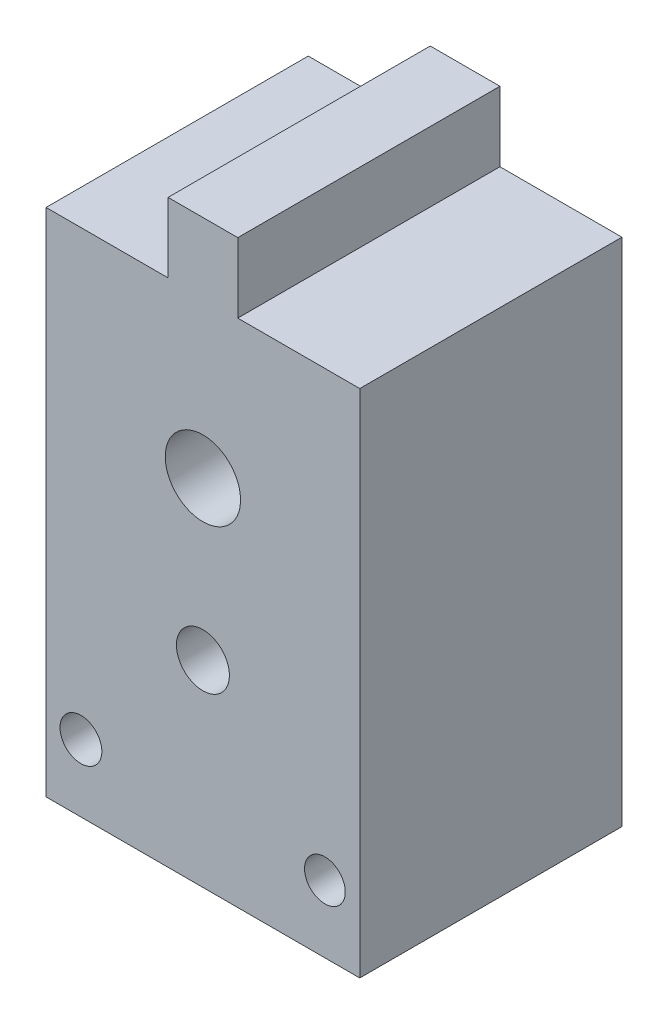
from build123d import *

# Parameters (mm, degrees)
SKETCH1_R           = 1.896742857
SKETCH1_R_2         = 1.45833049
SKETCH1_R_3         = 1.497428571
SKETCH1_R_4         = 2.695371429
BOSS_EXTRUDE1_DEPTH = 9.3865


with BuildPart() as part:
    # Sketch1 → Boss-Extrude1 (new, symmetric)
    with BuildSketch(Plane.XY):
        Polygon((-2.495714286, 15.780977349), (-11.230714286, 15.780977349), (-11.230714286, -20.77240592), (11.230714286, -20.77240592), (11.230714286, 15.780977349), (2.495714286, 15.780977349), (2.495714286, 20.77240592), (-2.495714286, 20.77240592), align=None)
        with Locations(Location((0, -6.680451222, 0), (0, 0, 180))):
            Circle(SKETCH1_R, mode=Mode.SUBTRACT)
        with Locations(Location((8.735, -15.964508365, 0), (0, 0, 180))):
            Circle(SKETCH1_R_2, mode=Mode.SUBTRACT)
        with Locations(Location((-8.735, -15.964508365, 0), (0, 0, 180))):
            Circle(SKETCH1_R_3, mode=Mode.SUBTRACT)
        with Locations(Location((0, 4.600177349, 0), (0, 0, 180))):
            Circle(SKETCH1_R_4, mode=Mode.SUBTRACT)
    extrude(amount=BOSS_EXTRUDE1_DEPTH, both=True)


solid = part.part
